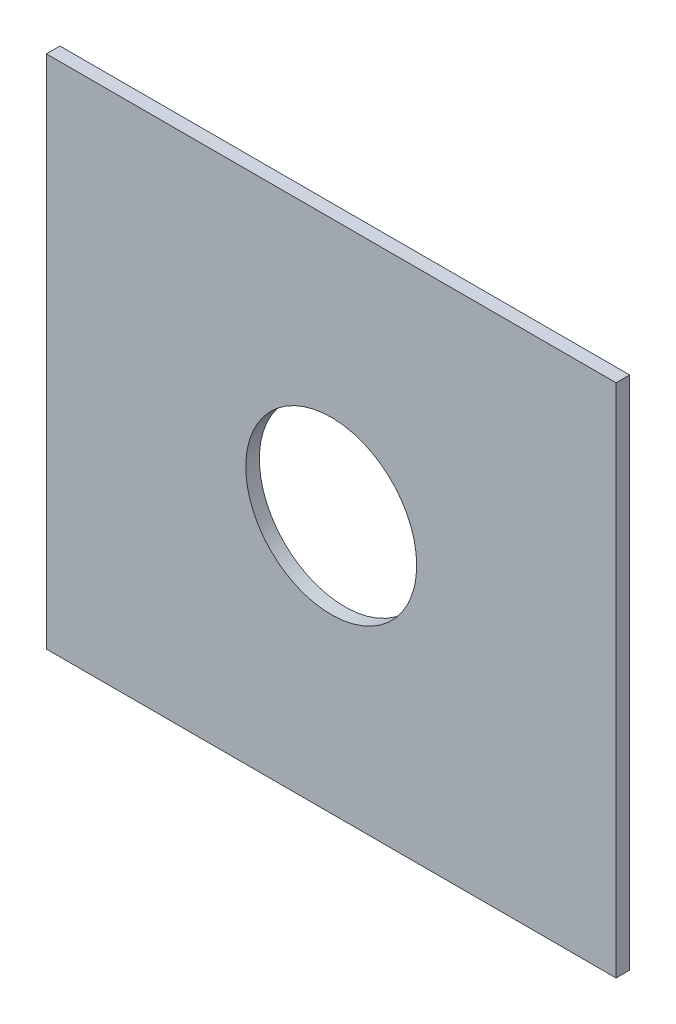
from build123d import *

# Parameters (mm, degrees)
LOCAL_SECOND_LAYER_AND_BORE_PROFILE_W = 42
LOCAL_SECOND_LAYER_AND_BORE_PROFILE_H = 38
LOCAL_SECOND_LAYER_AND_BORE_PROFILE_R = 6.3
LOCAL_SECOND_LAYER_AND_BORE_DEPTH     = 1


with BuildPart() as part:
    # Local second layer and bore profile → Local second layer and bore (new body)
    with BuildSketch(Plane.XY):
        with Locations((0, 28.5)):
            Rectangle(LOCAL_SECOND_LAYER_AND_BORE_PROFILE_W, LOCAL_SECOND_LAYER_AND_BORE_PROFILE_H)
        with Locations((0, 28.5)):
            Circle(LOCAL_SECOND_LAYER_AND_BORE_PROFILE_R, mode=Mode.SUBTRACT)
    extrude(amount=LOCAL_SECOND_LAYER_AND_BORE_DEPTH)


solid = part.part
